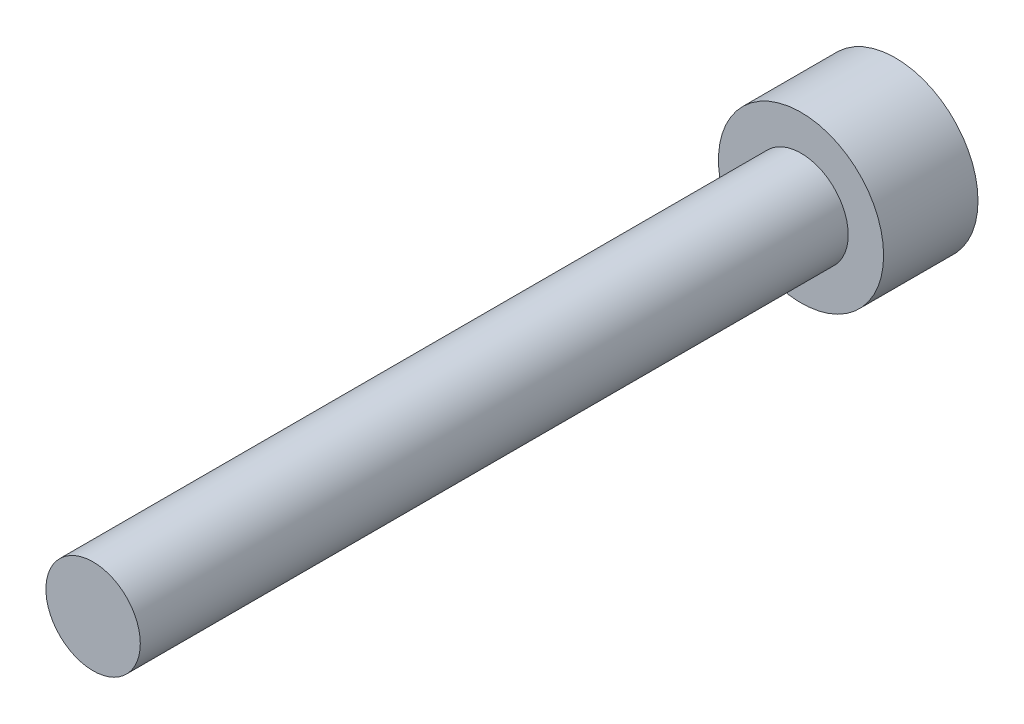
from build123d import *

# Parameters (mm, degrees)
SKETCH_1_R        = 3.5
EXTRUDE_321_DEPTH = 4
SKETCH_2_R        = 2
EXTRUDE_2_DEPTH   = 30


with BuildPart() as part:
    # Эскиз1 → Extrude 321 (new body)
    with BuildSketch(Plane.XY):
        Circle(SKETCH_1_R)
    extrude(amount=EXTRUDE_321_DEPTH)

    # Эскиз2 → Бобышка-Вытянуть2 (add)
    with BuildSketch(Plane.XY.offset(4)):
        Circle(SKETCH_2_R)
    extrude(amount=EXTRUDE_2_DEPTH)


solid = part.part
